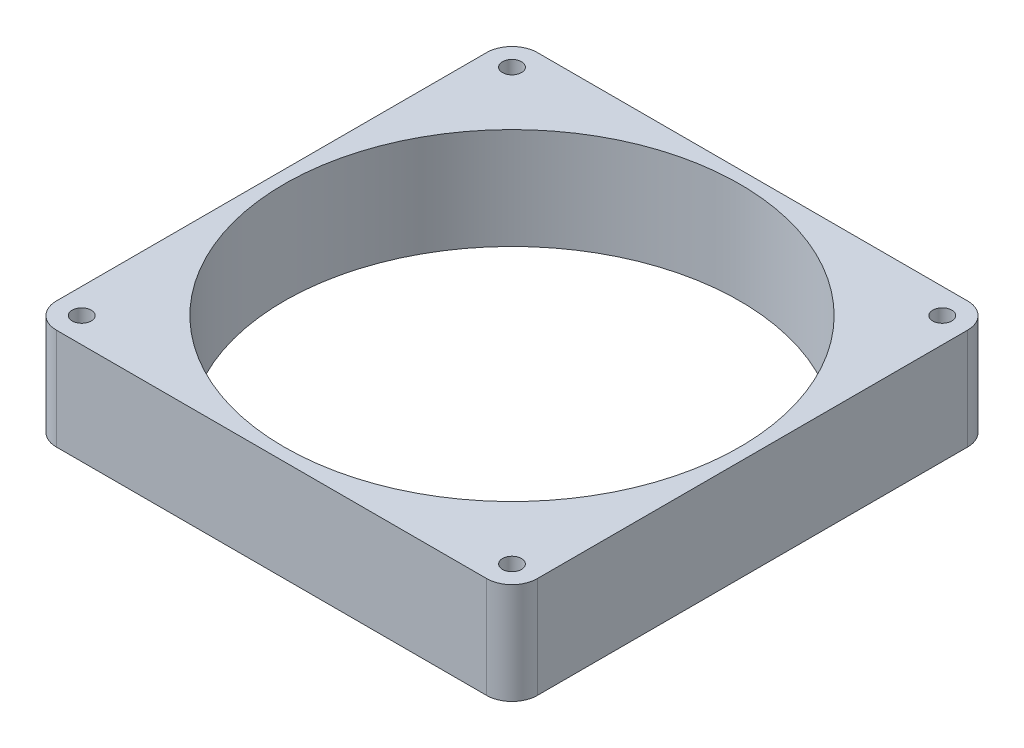
from build123d import *

# Parameters (mm, degrees)
SKETCH1_W           = 120.65
SKETCH1_H           = 120.65
BOSS_EXTRUDE1_DEPTH = 25.4
FILLET1_R           = 6.35
FILLET2_R           = 6.35
SKETCH2_R           = 2.38125
CUT_EXTRUDE1_DEPTH  = 137.199111623
SKETCH4_R           = 57.15
CUT_EXTRUDE2_DEPTH  = 25.4


with BuildPart() as part:
    # Sketch1 → Boss-Extrude1 (new body)
    with BuildSketch(Plane(origin=(0, 0, 0), x_dir=(1, 0, 0), z_dir=(0, 1, 0))):
        with Locations((27.733831169, -40.425584416)):
            Rectangle(SKETCH1_W, SKETCH1_H)
    extrude(amount=BOSS_EXTRUDE1_DEPTH)

    # Fillet1
    fillet1_edges = [part.edges().sort_by_distance(p)[0] for p in [
        (-32.591168831, 12.7, 100.750584416),
    ]]
    fillet(fillet1_edges, radius=FILLET1_R)

    # Fillet2
    fillet2_edges = [part.edges().sort_by_distance(p)[0] for p in [
        (-32.591168831, 12.7, -19.899415584),
        (88.058831169, 12.7, -19.899415584),
        (88.058831169, 12.7, 100.750584416),
    ]]
    fillet(fillet2_edges, radius=FILLET2_R)

    # Sketch2 → Cut-Extrude1 (cut, through all)
    with BuildSketch(Plane(origin=(0, 25.4, 0), x_dir=(1, 0, 0), z_dir=(0, 1, 0))):
        with Locations(Location((-26.241168831, -94.400584416, 0), (0, 0, 270))):
            Circle(SKETCH2_R)
        with Locations(Location((-26.241168831, 13.549415584, 0), (0, 0, 270))):
            Circle(SKETCH2_R)
        with Locations(Location((81.708831169, 13.549415584, 0), (0, 0, 270))):
            Circle(SKETCH2_R)
        with Locations(Location((81.708831169, -94.400584416, 0), (0, 0, 270))):
            Circle(SKETCH2_R)
    extrude(amount=-CUT_EXTRUDE1_DEPTH, mode=Mode.SUBTRACT)

    # Sketch4 → Cut-Extrude2 (cut)
    with BuildSketch(Plane(origin=(0, 25.4, 0), x_dir=(1, 0, 0), z_dir=(0, 1, 0))):
        with Locations(Location((27.733831169, -40.425584416, 0), (0, 0, 270))):
            Circle(SKETCH4_R)
    extrude(amount=-CUT_EXTRUDE2_DEPTH, mode=Mode.SUBTRACT)


solid = part.part
